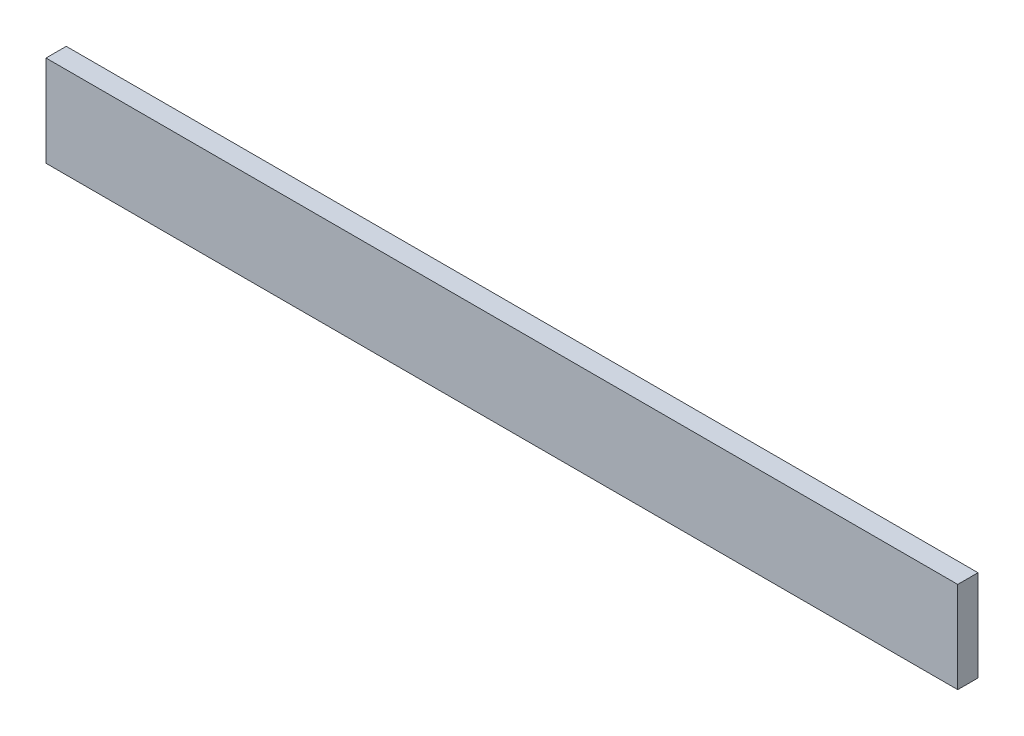
from build123d import *

# Parameters (mm, degrees)
BOSS_EXTRUDE1_DEPTH      = 10
BOSS_EXTRUDE1_DEPTH_BACK = 10
SKETCH1_W                = 900
SKETCH1_H                = 90


with BuildPart() as part:
    # Sketch1 → Boss-Extrude1 (new, two sides: drawn at the far end of the back side and taken through both)
    with BuildSketch(Plane.XY.offset(-BOSS_EXTRUDE1_DEPTH_BACK)):
        with Locations((-295.333333333, 0)):
            Rectangle(SKETCH1_W, SKETCH1_H)
    extrude(amount=BOSS_EXTRUDE1_DEPTH + BOSS_EXTRUDE1_DEPTH_BACK)


solid = part.part
